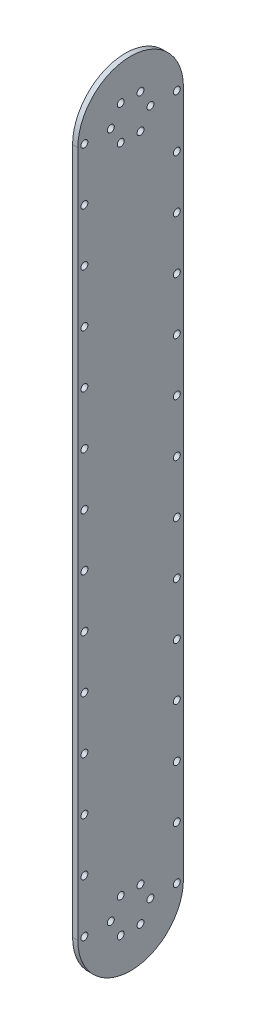
from build123d import *

# Parameters (mm, degrees)
BOSS_EXTRUDE1_DEPTH = 3.175
SKETCH2_R           = 2.1
CUT_EXTRUDE1_DEPTH  = 243.144751389
SKETCH3_R           = 2.1
CUT_EXTRUDE2_DEPTH  = 10
SKETCH4_R           = 2.1
CUT_EXTRUDE3_DEPTH  = 243.144751389


with BuildPart() as part:
    # Sketch1 → Boss-Extrude1 (new body)
    with BuildSketch(Plane.YZ):
        with BuildLine():
            Line((-208, 32), (208, 32))
            ThreePointArc((208, 32), (240, 0), (208, -32))
            Line((208, -32), (-208, -32))
            ThreePointArc((-208, -32), (-240, 0), (-208, 32))
        make_face()
    extrude(amount=BOSS_EXTRUDE1_DEPTH)

    # Sketch2 → Cut-Extrude1 (cut, through all)
    with BuildSketch(Plane.YZ.offset(3.175)):
        with Locations(Location((208, 12, 0), (0, 0, 270))):
            Circle(SKETCH2_R)
        with Locations(Location((218.392304845, 6, 0), (0, 0, 270))):
            Circle(SKETCH2_R)
        with Locations(Location((218.392304845, -6, 0), (0, 0, 270))):
            Circle(SKETCH2_R)
        with Locations(Location((208, -12, 0), (0, 0, 270))):
            Circle(SKETCH2_R)
        with Locations(Location((197.607695155, -6, 0), (0, 0, 270))):
            Circle(SKETCH2_R)
        with Locations(Location((197.607695155, 6, 0), (0, 0, 270))):
            Circle(SKETCH2_R)
    extrude(amount=-CUT_EXTRUDE1_DEPTH, mode=Mode.SUBTRACT)

    # Sketch3 → Cut-Extrude2 (cut)
    with BuildSketch(Plane.YZ.offset(3.175)):
        with Locations(Location((-208, -12, 0), (0, 0, 270))):
            Circle(SKETCH3_R)
        with Locations(Location((-197.607695155, -6, 0), (0, 0, 270))):
            Circle(SKETCH3_R)
        with Locations(Location((-197.607695155, 6, 0), (0, 0, 270))):
            Circle(SKETCH3_R)
        with Locations(Location((-208, 12, 0), (0, 0, 270))):
            Circle(SKETCH3_R)
        with Locations(Location((-218.392304845, 6, 0), (0, 0, 270))):
            Circle(SKETCH3_R)
        with Locations(Location((-218.392304845, -6, 0), (0, 0, 270))):
            Circle(SKETCH3_R)
    extrude(amount=-CUT_EXTRUDE2_DEPTH, mode=Mode.SUBTRACT)

    # Sketch4 → Cut-Extrude3 (cut, through all)
    with BuildSketch(Plane.YZ.offset(3.175)):
        with Locations(Location((-208, 12, 0), (0, 0, 270))):
            Circle(SKETCH4_R)
        with Locations(Location((-208, 28, 0), (0, 0, 270))):
            Circle(SKETCH4_R)
        with Locations(Location((-208, -28, 0), (0, 0, 90))):
            Circle(SKETCH4_R)
        with Locations(Location((-176, 28, 0), (0, 0, 270))):
            Circle(SKETCH4_R)
        with Locations(Location((-176, -28, 0), (0, 0, 90))):
            Circle(SKETCH4_R)
        with Locations(Location((-144, 28, 0), (0, 0, 270))):
            Circle(SKETCH4_R)
        with Locations(Location((-144, -28, 0), (0, 0, 90))):
            Circle(SKETCH4_R)
        with Locations(Location((-112, 28, 0), (0, 0, 270))):
            Circle(SKETCH4_R)
        with Locations(Location((-112, -28, 0), (0, 0, 90))):
            Circle(SKETCH4_R)
        with Locations(Location((-80, 28, 0), (0, 0, 270))):
            Circle(SKETCH4_R)
        with Locations(Location((-80, -28, 0), (0, 0, 90))):
            Circle(SKETCH4_R)
        with Locations(Location((-48, 28, 0), (0, 0, 270))):
            Circle(SKETCH4_R)
        with Locations(Location((-48, -28, 0), (0, 0, 90))):
            Circle(SKETCH4_R)
        with Locations(Location((-16, 28, 0), (0, 0, 270))):
            Circle(SKETCH4_R)
        with Locations(Location((-16, -28, 0), (0, 0, 90))):
            Circle(SKETCH4_R)
        with Locations(Location((16, 28, 0), (0, 0, 270))):
            Circle(SKETCH4_R)
        with Locations(Location((16, -28, 0), (0, 0, 90))):
            Circle(SKETCH4_R)
        with Locations(Location((48, 28, 0), (0, 0, 270))):
            Circle(SKETCH4_R)
        with Locations(Location((48, -28, 0), (0, 0, 90))):
            Circle(SKETCH4_R)
        with Locations(Location((80, 28, 0), (0, 0, 270))):
            Circle(SKETCH4_R)
        with Locations(Location((80, -28, 0), (0, 0, 90))):
            Circle(SKETCH4_R)
        with Locations(Location((112, 28, 0), (0, 0, 270))):
            Circle(SKETCH4_R)
        with Locations(Location((112, -28, 0), (0, 0, 90))):
            Circle(SKETCH4_R)
        with Locations(Location((144, 28, 0), (0, 0, 270))):
            Circle(SKETCH4_R)
        with Locations(Location((144, -28, 0), (0, 0, 90))):
            Circle(SKETCH4_R)
        with Locations(Location((176, 28, 0), (0, 0, 270))):
            Circle(SKETCH4_R)
        with Locations(Location((176, -28, 0), (0, 0, 90))):
            Circle(SKETCH4_R)
        with Locations(Location((208, 28, 0), (0, 0, 270))):
            Circle(SKETCH4_R)
        with Locations(Location((208, -28, 0), (0, 0, 90))):
            Circle(SKETCH4_R)
    extrude(amount=-CUT_EXTRUDE3_DEPTH, mode=Mode.SUBTRACT)


solid = part.part
